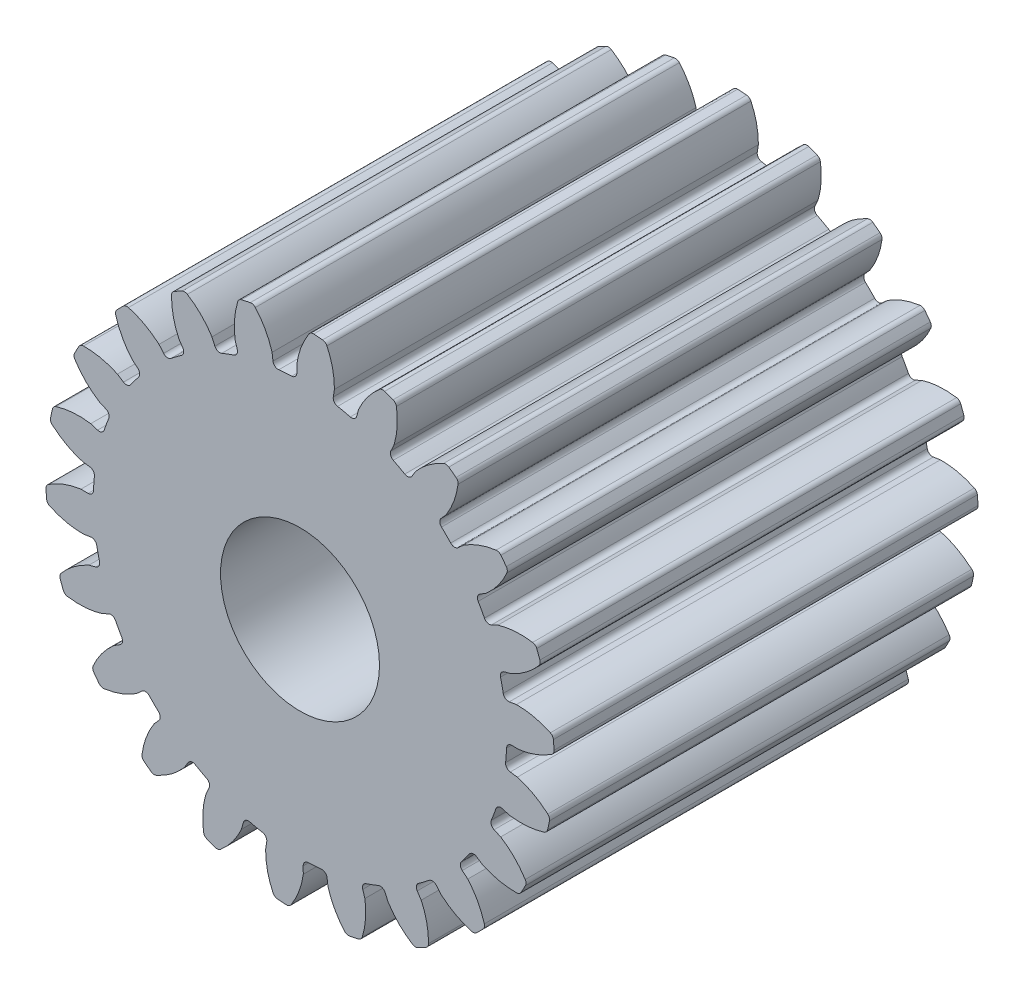
from build123d import *

# Parameters (mm, degrees)
SKETCH_1_R                       = 3.9
SKETCH_1_R_2                     = 1.5
EXTRUDE_1_DEPTH                  = 4
EXTRUDE_2_DEPTH                  = 4
FILLET_1_R                       = 0.1
PATTERN_CIRCULAR_1_COUNT         = 22
FILLET_1_OF_PATTERN_CIRCULAR_1_R = 0.1


with BuildPart() as part:
    # Эскиз1 → Бобышка-Вытянуть1 (new, symmetric)
    with BuildSketch(Plane.XY):
        Circle(SKETCH_1_R)
        Circle(SKETCH_1_R_2, mode=Mode.SUBTRACT)
    extrude(amount=EXTRUDE_1_DEPTH, both=True)

    # Эскиз2 → Бобышка-Вытянуть2 (add, symmetric)
    with BuildSketch(Plane.XY):
        with BuildLine():
            Line((-0.061622092, 4.134188303), (-0.058124945, 3.899566834))
            ThreePointArc((-0.058124945, 3.899566834), (0.278222814, 3.890063247), (0.61249954, 3.851602824))
            Line((0.61249954, 3.851602824), (0.649351208, 4.083338489))
            add(Edge.make_bspline(
                [(0.649351208, 4.083338489), (0.651289733, 4.447303805), (0.483103943, 4.775626721)],
                knots=[0, 0, 0, 1, 1, 1], degree=2))
            ThreePointArc((0.483103943, 4.775626721), (0.342428079, 4.78777015), (0.201455903, 4.795770587))
            add(Edge.make_bspline(
                [(-0.061622092, 4.134188303), (-0.011743221, 4.494724858), (0.201455903, 4.795770587)],
                knots=[0, 0, 0, 1, 1, 1], degree=2))
        make_face()
    extrude_2 = extrude(amount=EXTRUDE_2_DEPTH, both=True)

    # Скругление1
    fillet_1_edges = [part.edges().sort_by_distance(p)[0] for p in [
        (-0.058124945, 3.899566834, 0),
        (0.61249954, 3.851602824, 0),
        (0.483103943, 4.775626721, 2),
        (0.201455903, 4.795770587, -2),
    ]]
    fillet(fillet_1_edges, radius=FILLET_1_R)

    # Круговой массив1: Бобышка-Вытянуть2 ×22 about axis
    pattern_circular_1_axis = Axis((0, 0, 4), (0, 0, -1))
    for i in range(1, PATTERN_CIRCULAR_1_COUNT):
        add(extrude_2.rotate(pattern_circular_1_axis, i * 360 / PATTERN_CIRCULAR_1_COUNT))

    # Скругление1 of Круговой массив1
    fillet_1_of_pattern_circular_1_edges = [part.edges().sort_by_distance(p)[0] for p in [
        (1.042864458, 3.757982666, 0),
        (1.672810917, 3.523024785, 0),
        (1.808984366, 4.446074174, 2),
        (1.544420233, 4.544751494, -2),
        (2.059367185, 3.311949093, 0),
        (2.597601101, 2.909032231, 0),
        (2.988311633, 3.75632714, 2),
        (2.76226482, 3.925543665, -2),
        (2.909032231, 2.597601101, 0),
        (3.311949093, 2.059367185, 0),
        (3.925543665, 2.76226482, 2),
        (3.75632714, 2.988311633, -2),
        (3.523024785, 1.672810917, 0),
        (3.757982666, 1.042864458, 0),
        (4.544751494, 1.544420233, 2),
        (4.446074174, 1.808984366, -2),
        (3.851602824, 0.61249954, 0),
        (3.899566834, -0.058124945, 0),
        (4.795770587, 0.201455903, 2),
        (4.775626721, 0.483103943, -2),
        (3.868146908, -0.497432906, 0),
        (3.725231288, -1.154405411, 0),
        (4.658264868, -1.157829186, 2),
        (4.718286393, -0.881914688, -2),
        (3.571316735, -1.567066297, 0),
        (3.249099658, -2.157162816, 0),
        (4.143374233, -2.42331384, 2),
        (4.278698561, -2.175485835, -2),
        (2.985159719, -2.509745296, 0),
        (2.509745296, -2.985159719, 0),
        (3.292812059, -3.492476019, 2),
        (3.492476019, -3.292812059, -2),
        (2.157162816, -3.249099658, 0),
        (1.567066297, -3.571316735, 0),
        (2.175485835, -4.278698561, 2),
        (2.42331384, -4.143374233, -2),
        (1.154405411, -3.725231288, 0),
        (0.497432906, -3.868146908, 0),
        (0.881914688, -4.718286393, 2),
        (1.157829186, -4.658264868, -2),
        (0.058124945, -3.899566834, 0),
        (-0.61249954, -3.851602824, 0),
        (-0.483103943, -4.775626721, 2),
        (-0.201455903, -4.795770587, -2),
        (-1.042864458, -3.757982666, 0),
        (-1.672810917, -3.523024785, 0),
        (-1.808984366, -4.446074174, 2),
        (-1.544420233, -4.544751494, -2),
        (-2.059367185, -3.311949093, 0),
        (-2.597601101, -2.909032231, 0),
        (-2.988311633, -3.75632714, 2),
        (-2.76226482, -3.925543665, -2),
        (-2.909032231, -2.597601101, 0),
        (-3.311949093, -2.059367185, 0),
        (-3.925543665, -2.76226482, 2),
        (-3.75632714, -2.988311633, -2),
        (-3.523024785, -1.672810917, 0),
        (-3.757982666, -1.042864458, 0),
        (-4.544751494, -1.544420233, 2),
        (-4.446074174, -1.808984366, -2),
        (-3.851602824, -0.61249954, 0),
        (-3.899566834, 0.058124945, 0),
        (-4.795770587, -0.201455903, 2),
        (-4.775626721, -0.483103943, -2),
        (-3.868146908, 0.497432906, 0),
        (-3.725231288, 1.154405411, 0),
        (-4.658264868, 1.157829186, 2),
        (-4.718286393, 0.881914688, -2),
        (-3.571316735, 1.567066297, 0),
        (-3.249099658, 2.157162816, 0),
        (-4.143374233, 2.42331384, 2),
        (-4.278698561, 2.175485835, -2),
        (-2.985159719, 2.509745296, 0),
        (-2.509745296, 2.985159719, 0),
        (-3.292812059, 3.492476019, 2),
        (-3.492476019, 3.292812059, -2),
        (-2.157162816, 3.249099658, 0),
        (-1.567066297, 3.571316735, 0),
        (-2.175485835, 4.278698561, 2),
        (-2.42331384, 4.143374233, -2),
        (-1.154405411, 3.725231288, 0),
        (-0.497432906, 3.868146908, 0),
        (-0.881914688, 4.718286393, 2),
        (-1.157829186, 4.658264868, -2),
    ]]
    fillet(fillet_1_of_pattern_circular_1_edges, radius=FILLET_1_OF_PATTERN_CIRCULAR_1_R)


solid = part.part
